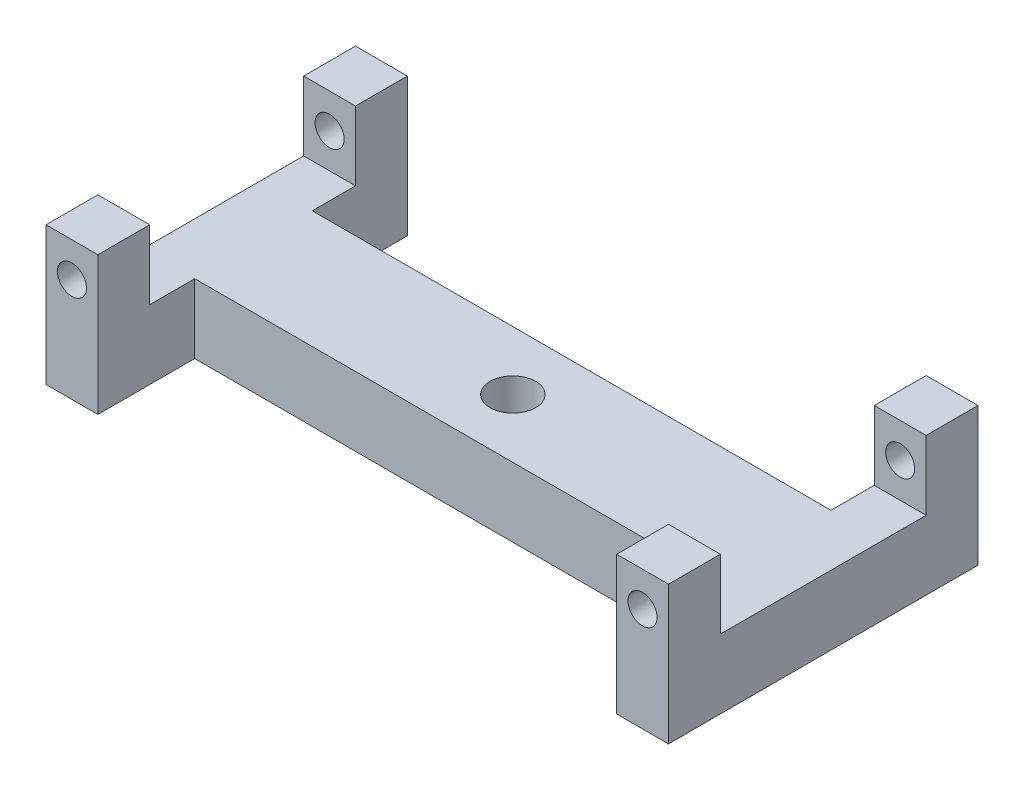
from build123d import *

# Parameters (mm, degrees)
SKETCH1_W               = 114.3
SKETCH1_H               = 21.59
SKETCH1_R               = 4.191
BOSS_EXTRUDE1_DEPTH     = 6.35
SKETCH2_W               = 9.525
SKETCH2_H               = 6.35
BOSS_EXTRUDE2_DEPTH     = 17.4625
SKETCH3_W               = 9.525
SKETCH3_H               = 6.35
BOSS_EXTRUDE3_DEPTH     = 17.4625
SKETCH4_W               = 9.525
SKETCH4_H               = 6.35
BOSS_EXTRUDE4_DEPTH     = 17.78
SKETCH6_W               = 9.525
SKETCH6_H               = 9.525
BOSS_EXTRUDE5_DEPTH     = 12.7
CUT_EXTRUDE1_DEPTH      = 53.848
CUT_EXTRUDE1_DEPTH_BACK = 92.456
SKETCH7_R               = 2.667
BOSS_EXTRUDE6_DEPTH     = 6.35
CUT_EXTRUDE2_START      = -6.35
SKETCH10_R              = 4.191
CUT_EXTRUDE2_DEPTH      = 6.35
SKETCH11_R              = 7.14375
CUT_EXTRUDE3_DEPTH      = 6.73125


with BuildPart() as part:
    # Sketch1 → Boss-Extrude1 (new body)
    with BuildSketch(Plane(origin=(0, 0, 0), x_dir=(1, 0, 0), z_dir=(0, 1, 0))):
        Rectangle(SKETCH1_W, SKETCH1_H)
        with Locations(Location((0, 0, 0), (0, 0, 270))):
            Circle(SKETCH1_R, mode=Mode.SUBTRACT)
    extrude(amount=BOSS_EXTRUDE1_DEPTH)

    # Sketch2 → Boss-Extrude2 (add)
    with BuildSketch(Plane(origin=(0, 0, -10.795), x_dir=(-1, 0, 0), z_dir=(0, 0, -1))):
        with Locations((-52.3875, 3.175)):
            Rectangle(SKETCH2_W, SKETCH2_H)
    extrude(amount=BOSS_EXTRUDE2_DEPTH)

    # Sketch3 → Boss-Extrude3 (add)
    with BuildSketch(Plane(origin=(0, 0, -10.795), x_dir=(-1, 0, 0), z_dir=(0, 0, -1))):
        with Locations((52.3875, 3.175)):
            Rectangle(SKETCH3_W, SKETCH3_H)
    extrude(amount=BOSS_EXTRUDE3_DEPTH)

    # Sketch4 → Boss-Extrude4 (add)
    with BuildSketch(Plane.XY.offset(10.795)):
        with Locations((-52.3875, 3.175)):
            Rectangle(SKETCH4_W, SKETCH4_H)
        with Locations((52.3875, 3.175)):
            Rectangle(SKETCH4_W, SKETCH4_H)
    extrude(amount=BOSS_EXTRUDE4_DEPTH)

    # Sketch6 → Boss-Extrude5 (add)
    with BuildSketch(Plane(origin=(0, 6.35, 0), x_dir=(1, 0, 0), z_dir=(0, 1, 0))):
        with Locations((-52.3875, 23.495)):
            Rectangle(SKETCH6_W, SKETCH6_H)
        with Locations((-52.3875, -23.8125)):
            Rectangle(SKETCH6_W, SKETCH6_H)
        with Locations((52.3875, 23.495)):
            Rectangle(SKETCH6_W, SKETCH6_H)
        with Locations((52.3875, -23.8125)):
            Rectangle(SKETCH6_W, SKETCH6_H)
    extrude(amount=BOSS_EXTRUDE5_DEPTH)

    # Sketch7 → Cut-Extrude1 (cut, two sides: drawn at the far end of the back side and taken through both)
    with BuildSketch(Plane(origin=(0, 0, -28.2575), x_dir=(-1, 0, 0), z_dir=(0, 0, -1)).offset(-CUT_EXTRUDE1_DEPTH_BACK)):
        with Locations(Location((-52.3875, 12.7, 0), (0, 0, 180))):
            Circle(SKETCH7_R)
        with Locations(Location((52.3875, 12.7, 0), (0, 0, 180))):
            Circle(SKETCH7_R)
    extrude(amount=CUT_EXTRUDE1_DEPTH + CUT_EXTRUDE1_DEPTH_BACK, mode=Mode.SUBTRACT)

    # Sketch9 → Boss-Extrude6 (add)
    with BuildSketch(Plane.XZ):
        Polygon((57.15, -28.2575), (57.15, 28.575), (47.625, 28.575), (47.625, 10.795), (-47.625, 10.795), (-47.625, 28.575), (-57.15, 28.575), (-57.15, -28.2575), (-47.625, -28.2575), (-47.625, -10.795), (47.625, -10.795), (47.625, -28.2575), align=None)
    extrude(amount=BOSS_EXTRUDE6_DEPTH)

    # Sketch10 → Cut-Extrude2 (cut)
    with BuildSketch(Plane(origin=(0, 0, 0), x_dir=(1, 0, 0), z_dir=(0, 1, 0)).offset(CUT_EXTRUDE2_START)):
        with Locations(Location((0, 0, 0), (0, 0, 90))):
            Circle(SKETCH10_R)
    extrude(amount=CUT_EXTRUDE2_DEPTH, mode=Mode.SUBTRACT)

    # Sketch11 → Cut-Extrude3 (cut)
    with BuildSketch(Plane.XZ.offset(6.35)):
        with Locations(Location((0, 0, 0), (0, 0, 270))):
            Circle(SKETCH11_R)
    extrude(amount=-CUT_EXTRUDE3_DEPTH, mode=Mode.SUBTRACT)


solid = part.part
